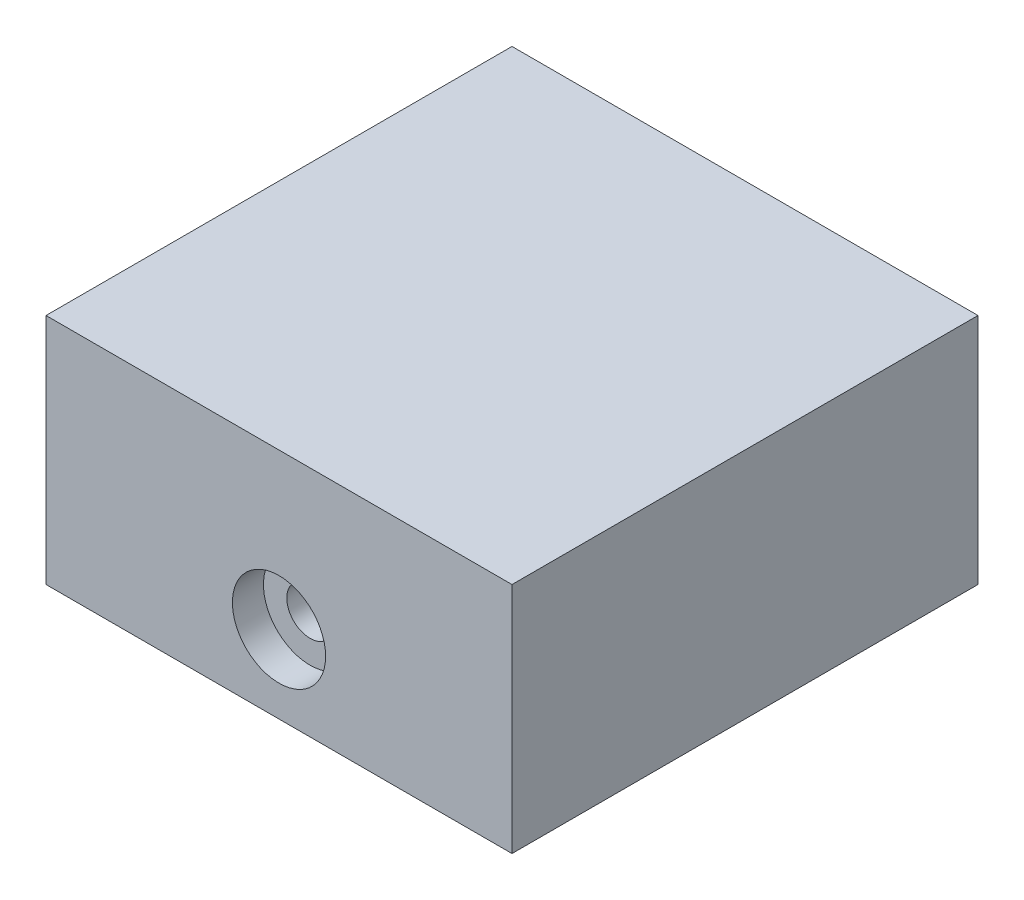
from build123d import *

# Parameters (mm, degrees)
SKETCH1_W           = 30
SKETCH1_H           = 30
BOSS_EXTRUDE1_DEPTH = 15
SKETCH2_W           = 20
SKETCH2_H           = 20
CUT_EXTRUDE1_DEPTH  = 10
SKETCH3_R           = 1.5
CUT_EXTRUDE2_DEPTH  = 30
CUT_EXTRUDE3_DEPTH  = 2
SKETCH5_R           = 3
CUT_EXTRUDE4_DEPTH  = 2


with BuildPart() as part:
    # Sketch1 → Boss-Extrude1 (new body)
    with BuildSketch(Plane(origin=(0, 0, 0), x_dir=(1, 0, 0), z_dir=(0, 1, 0))):
        Rectangle(SKETCH1_W, SKETCH1_H)
    extrude(amount=BOSS_EXTRUDE1_DEPTH)

    # Sketch2 → Cut-Extrude1 (cut)
    with BuildSketch(Plane.XZ):
        Rectangle(SKETCH2_W, SKETCH2_H)
    extrude(amount=-CUT_EXTRUDE1_DEPTH, mode=Mode.SUBTRACT)

    # Sketch3 → Cut-Extrude2 (cut)
    with BuildSketch(Plane(origin=(0, 0, -15), x_dir=(-1, 0, 0), z_dir=(0, 0, -1))):
        with Locations((0, 5)):
            Circle(SKETCH3_R)
    extrude(amount=-CUT_EXTRUDE2_DEPTH, mode=Mode.SUBTRACT)

    # Sketch4 → Cut-Extrude3 (cut)
    with BuildSketch(Plane(origin=(0, 0, -15), x_dir=(-1, 0, 0), z_dir=(0, 0, -1))):
        Polygon((0, 2.070756219), (2.536799528, 3.53537811), (2.536799528, 6.46462189), (0, 7.929243781), (-2.536799528, 6.46462189), (-2.536799528, 3.53537811), align=None)
    extrude(amount=-CUT_EXTRUDE3_DEPTH, mode=Mode.SUBTRACT)

    # Sketch5 → Cut-Extrude4 (cut)
    with BuildSketch(Plane.XY.offset(15)):
        with Locations((0, 5)):
            Circle(SKETCH5_R)
    extrude(amount=-CUT_EXTRUDE4_DEPTH, mode=Mode.SUBTRACT)


solid = part.part
